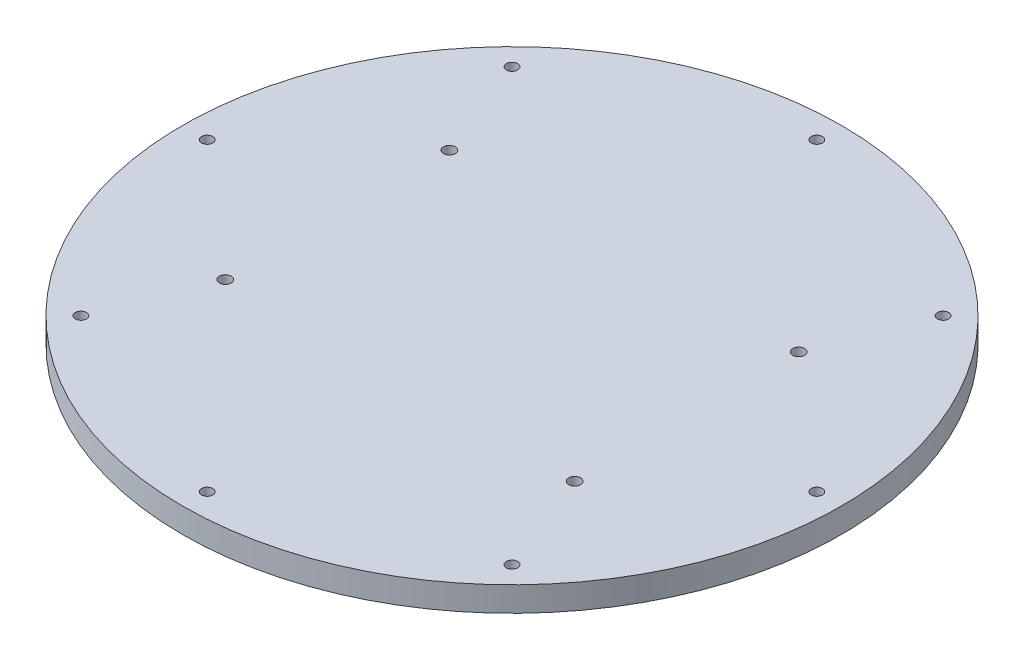
from build123d import *

# Parameters (mm, degrees)
SKETCH1_R                      = 100
BOSS_EXTRUDE1_DEPTH            = 7.5
CBORE_FOR_M3_SHCS1_D           = 3.4
CBORE_FOR_M3_SHCS1_DEPTH       = 7.5
CBORE_FOR_M3_SHCS1_CBORE_D     = 6.5
CBORE_FOR_M3_SHCS1_CBORE_DEPTH = 3
CBORE_FOR_M3_SHCS1_TIP         = 1.021463052
CBORE_FOR_M3_SHCS2_D           = 3.6
CBORE_FOR_M3_SHCS2_DEPTH       = 7.5
CBORE_FOR_M3_SHCS2_CBORE_D     = 6.5
CBORE_FOR_M3_SHCS2_CBORE_DEPTH = 3
CBORE_FOR_M3_SHCS2_TIP         = 1.081549114


with BuildPart() as part:
    # Sketch1 → Boss-Extrude1 (new body)
    with BuildSketch(Plane(origin=(0, 0, 0), x_dir=(1, 0, 0), z_dir=(0, 1, 0))):
        with Locations(Location((0, 0, 0), (0, 0, 270))):
            Circle(SKETCH1_R)
    extrude(amount=BOSS_EXTRUDE1_DEPTH)

    # CBORE for M3 SHCS1
    with Locations(Plane(origin=(0, 0, 0), x_dir=(-1, 0, 0), z_dir=(0, -1, 0))):
        with Locations((0, -92.5), (-65.40737726, -65.40737726), (-92.5, 0), (-65.40737726, 65.40737726), (0, 92.5), (65.40737726, 65.40737726), (92.5, 0), (65.40737726, -65.40737726)):
            CounterBoreHole(CBORE_FOR_M3_SHCS1_D / 2, CBORE_FOR_M3_SHCS1_CBORE_D / 2, CBORE_FOR_M3_SHCS1_CBORE_DEPTH, depth=CBORE_FOR_M3_SHCS1_DEPTH)
            with Locations((0, 0, -(CBORE_FOR_M3_SHCS1_DEPTH + CBORE_FOR_M3_SHCS1_TIP / 2))):  # 118° drill point
                Cone(0, CBORE_FOR_M3_SHCS1_D / 2, CBORE_FOR_M3_SHCS1_TIP, mode=Mode.SUBTRACT)

    # CBORE for M3 SHCS2
    with Locations(Plane(origin=(0, 0, 0), x_dir=(-1, 0, 0), z_dir=(0, -1, 0))):
        with Locations((-53, 34), (53, 34), (53, -34), (-53, -34)):
            CounterBoreHole(CBORE_FOR_M3_SHCS2_D / 2, CBORE_FOR_M3_SHCS2_CBORE_D / 2, CBORE_FOR_M3_SHCS2_CBORE_DEPTH, depth=CBORE_FOR_M3_SHCS2_DEPTH)
            with Locations((0, 0, -(CBORE_FOR_M3_SHCS2_DEPTH + CBORE_FOR_M3_SHCS2_TIP / 2))):  # 118° drill point
                Cone(0, CBORE_FOR_M3_SHCS2_D / 2, CBORE_FOR_M3_SHCS2_TIP, mode=Mode.SUBTRACT)


solid = part.part
